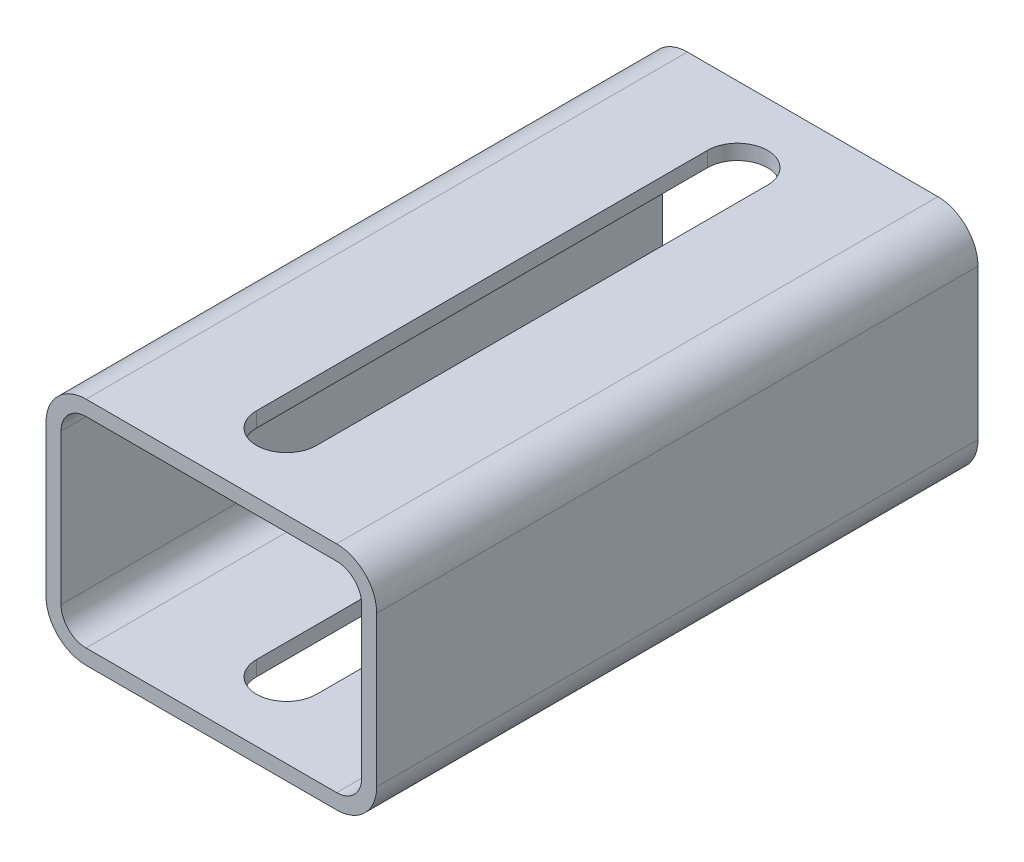
from build123d import *

# Parameters (mm, degrees)
EXTRUDE_THIN1_DEPTH = 60
CUT_EXTRUDE1_DEPTH  = 83.492423895


with BuildPart() as part:
    # Sketch2 → Extrude-Thin1 (new, symmetric)
    with BuildSketch(Plane.XY):
        with BuildLine():
            Line((33, 15), (33, -15))
            ThreePointArc((33, -15), (30.656854249, -20.656854249), (25, -23))
            Line((25, -23), (-25, -23))
            ThreePointArc((-25, -23), (-30.656854249, -20.656854249), (-33, -15))
            Line((-33, -15), (-33, 15))
            ThreePointArc((-33, 15), (-30.656854249, 20.656854249), (-25, 23))
            Line((-25, 23), (25, 23))
            ThreePointArc((25, 23), (30.656854249, 20.656854249), (33, 15))
        make_face()
        with BuildLine():
            Line((30, 15), (30, -15))
            ThreePointArc((30, -15), (28.535533906, -18.535533906), (25, -20))
            Line((25, -20), (-25, -20))
            ThreePointArc((-25, -20), (-28.535533906, -18.535533906), (-30, -15))
            Line((-30, -15), (-30, 15))
            ThreePointArc((-30, 15), (-28.535533906, 18.535533906), (-25, 20))
            Line((-25, 20), (25, 20))
            ThreePointArc((25, 20), (28.535533906, 18.535533906), (30, 15))
        make_face(mode=Mode.SUBTRACT)
    extrude(amount=EXTRUDE_THIN1_DEPTH, both=True)

    # Sketch4 → Cut-Extrude1 (cut, through all)
    with BuildSketch(Plane(origin=(0, 23, 0), x_dir=(1, 0, 0), z_dir=(0, 1, 0))):
        with BuildLine():
            Line((6, 45), (6, -45))
            ThreePointArc((6, -45), (0, -51), (-6, -45))
            Line((-6, -45), (-6, 45))
            ThreePointArc((-6, 45), (0, 51), (6, 45))
        make_face()
    extrude(amount=-CUT_EXTRUDE1_DEPTH, mode=Mode.SUBTRACT)


solid = part.part
